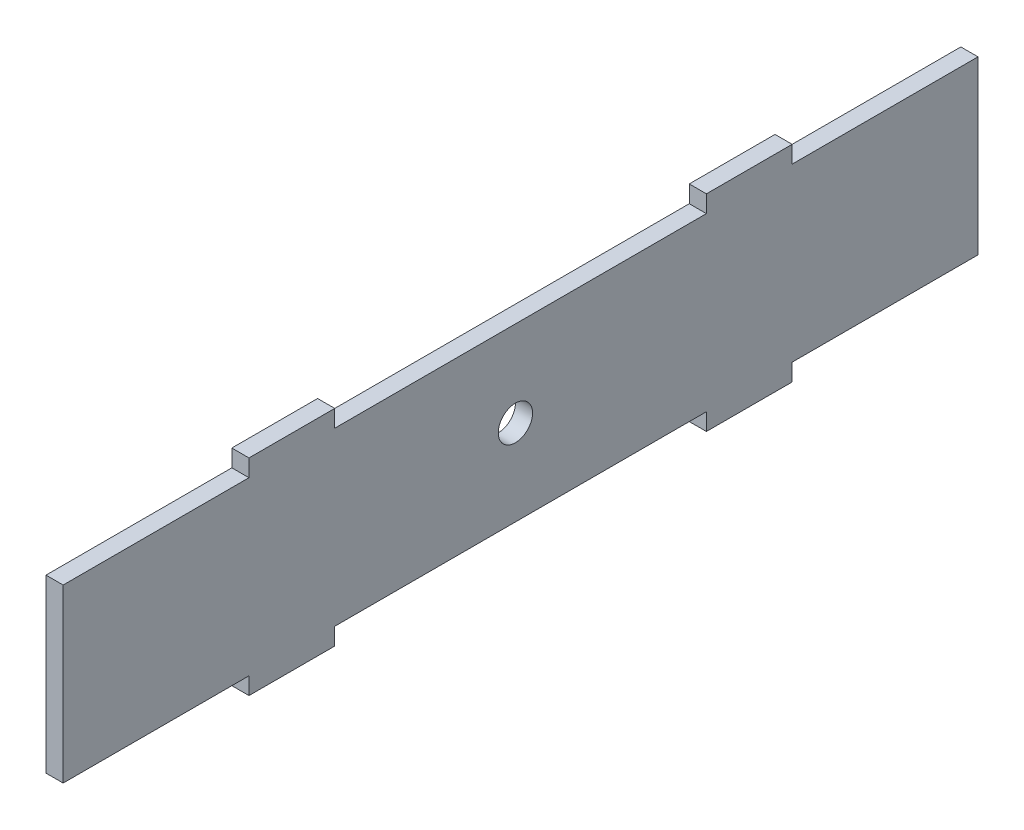
from build123d import *

# Parameters (mm, degrees)
SKETCH1_R           = 3
BOSS_EXTRUDE2_DEPTH = 3


with BuildPart() as part:
    # Sketch1 → Boss-Extrude2 (new body)
    with BuildSketch(Plane(origin=(0, 0, 0), x_dir=(0, 0, -1), z_dir=(1, 0, 0))):
        Polygon((0, 0), (32.5, 0), (32.5, 3), (47.5, 3), (47.5, 0), (112.5, 0), (112.5, 3), (127.5, 3), (127.5, 0), (160, 0), (160, -30), (127.5, -30), (127.5, -33), (112.5, -33), (112.5, -30), (47.5, -30), (47.5, -33), (32.5, -33), (32.5, -30), (0, -30), align=None)
        with Locations((79.096389196, -15)):
            Circle(SKETCH1_R, mode=Mode.SUBTRACT)
    extrude(amount=BOSS_EXTRUDE2_DEPTH)


solid = part.part
